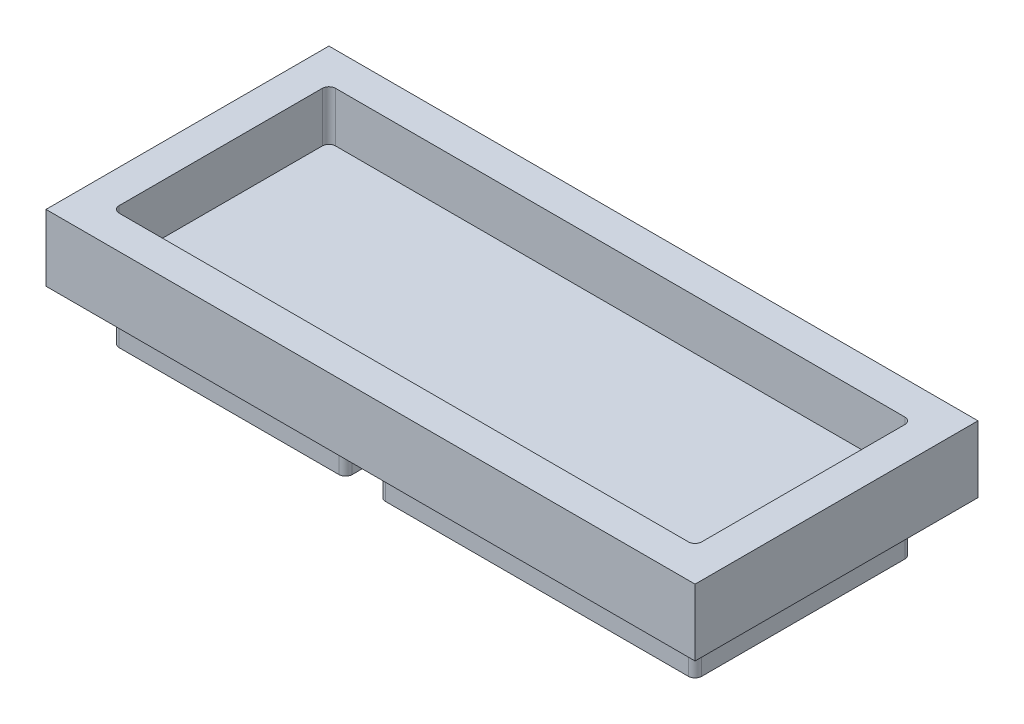
from build123d import *

# Parameters (mm, degrees)
BOSS_EXTRUDE2_DEPTH   = 15
BOSS_EXTRUDE2_2_DEPTH = 15
SKETCH2_W             = 195
SKETCH2_H             = 85
BOSS_EXTRUDE3_DEPTH   = 5
SKETCH3_W             = 195
SKETCH3_H             = 85
BOSS_EXTRUDE4_DEPTH   = 15


with BuildPart() as part:
    # Sketch1 → Boss-Extrude2 (new body)
    with BuildSketch(Plane(origin=(0, 0, 0), x_dir=(1, 0, 0), z_dir=(0, 1, 0))):
        with BuildLine():
            Line((-74.848214286, -3.705357143), (-74.848214286, 57.294642857))
            ThreePointArc((-74.848214286, 57.294642857), (-74.262427848, 58.70885642), (-72.848214286, 59.294642857))
            Line((-72.848214286, 59.294642857), (-6.848214286, 59.294642857))
            ThreePointArc((-6.848214286, 59.294642857), (-5.434000723, 58.70885642), (-4.848214286, 57.294642857))
            Line((-4.848214286, 57.294642857), (-4.848214286, -3.705357143))
            ThreePointArc((-4.848214286, -3.705357143), (-5.434000723, -5.119570705), (-6.848214286, -5.705357143))
            Line((-6.848214286, -5.705357143), (-72.848214286, -5.705357143))
            ThreePointArc((-72.848214286, -5.705357143), (-74.262427848, -5.119570705), (-74.848214286, -3.705357143))
        make_face()
    extrude(amount=BOSS_EXTRUDE2_DEPTH)



with BuildPart() as body_2:
    # Sketch1 → Boss-Extrude2 2 (new body)
    with BuildSketch(Plane(origin=(0, 0, 0), x_dir=(1, 0, 0), z_dir=(0, 1, 0))):
        with BuildLine():
            Line((100.151785714, -3.705357143), (100.151785714, 57.294642857))
            ThreePointArc((100.151785714, 57.294642857), (99.565999277, 58.70885642), (98.151785714, 59.294642857))
            Line((98.151785714, 59.294642857), (7.151785714, 59.294642857))
            ThreePointArc((7.151785714, 59.294642857), (5.737572152, 58.70885642), (5.151785714, 57.294642857))
            Line((5.151785714, 57.294642857), (5.151785714, -3.705357143))
            ThreePointArc((5.151785714, -3.705357143), (5.737572152, -5.119570705), (7.151785714, -5.705357143))
            Line((7.151785714, -5.705357143), (98.151785714, -5.705357143))
            ThreePointArc((98.151785714, -5.705357143), (99.565999277, -5.119570705), (100.151785714, -3.705357143))
        make_face()
    extrude(amount=BOSS_EXTRUDE2_2_DEPTH)


with BuildPart() as part_1:
    add(part.part)

    add(body_2.part)  # Boss-Extrude3 merges body 2
    # Sketch2 → Boss-Extrude3 (add)
    with BuildSketch(Plane(origin=(0, 15, 0), x_dir=(1, 0, 0), z_dir=(0, 1, 0))):
        with Locations((12.651785714, 26.794642857)):
            Rectangle(SKETCH2_W, SKETCH2_H)
    extrude(amount=BOSS_EXTRUDE3_DEPTH)

    # Sketch3 → Boss-Extrude4 (add)
    with BuildSketch(Plane(origin=(0, 20, 0), x_dir=(1, 0, 0), z_dir=(0, 1, 0))):
        with Locations((12.651785714, 26.794642857)):
            Rectangle(SKETCH3_W, SKETCH3_H)
        with BuildLine():
            Line((-74.848214286, 57.294642857), (-74.848214286, -3.705357143))
            ThreePointArc((-74.848214286, -3.705357143), (-74.262427848, -5.119570705), (-72.848214286, -5.705357143))
            Line((-72.848214286, -5.705357143), (98.151785714, -5.705357143))
            ThreePointArc((98.151785714, -5.705357143), (99.565999277, -5.119570705), (100.151785714, -3.705357143))
            Line((100.151785714, -3.705357143), (100.151785714, 57.294642857))
            ThreePointArc((100.151785714, 57.294642857), (99.565999277, 58.70885642), (98.151785714, 59.294642857))
            Line((98.151785714, 59.294642857), (-72.848214286, 59.294642857))
            ThreePointArc((-72.848214286, 59.294642857), (-74.262427848, 58.70885642), (-74.848214286, 57.294642857))
        make_face(mode=Mode.SUBTRACT)
    extrude(amount=BOSS_EXTRUDE4_DEPTH)


solid = part_1.part
